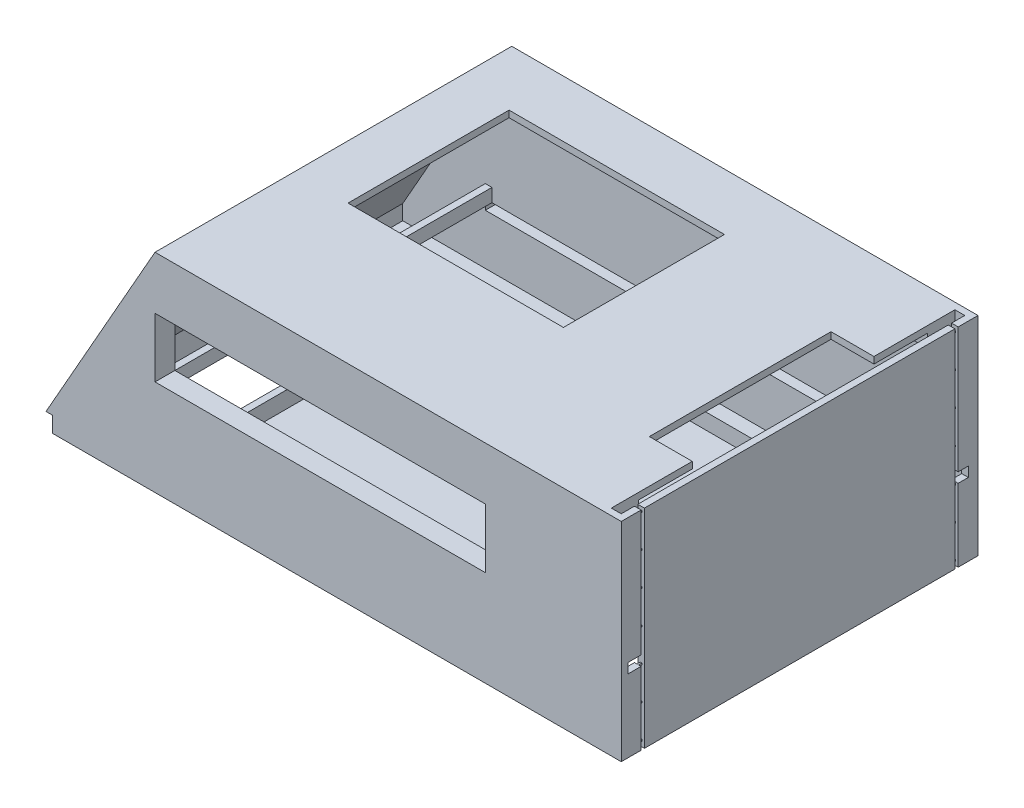
from build123d import *

# Parameters (mm, degrees)
SKETCH_1_W           = 174.15
SKETCH_1_H           = 108
EXTRUDE_1_DEPTH      = 63
CUT_EXTRUDE_2_DEPTH  = 174.15
CUT_EXTRUDE_3_REACH  = 122.279
SKETCH_6_W           = 2
SKETCH_6_H           = 108
SKETCH_7_W           = 96
SKETCH_7_H           = 50.25
CUT_EXTRUDE_5_DEPTH  = 168.15
SKETCH_8_W           = 87.5
SKETCH_8_H           = 4.75
CUT_EXTRUDE_6_DEPTH  = 168.15
SKETCH_10_W          = 168.15
SKETCH_10_H          = 87.5
CUT_EXTRUDE_8_DEPTH  = 59
SKETCH_12_W          = 168.15
SKETCH_12_H          = 96
EXTRUDE_2_DEPTH      = 2
SKETCH_15_W          = 25
SKETCH_15_H          = 70
SKETCH_15_W_2        = 55
SKETCH_15_H_2        = 20
SKETCH_15_W_3        = 44.398131355
SKETCH_15_H_3        = 87.5
CUT_EXTRUDE_9_DEPTH  = 2
SKETCH_16_W          = 25
SKETCH_16_H          = 96
SKETCH_16_W_2        = 32.283516817
CUT_EXTRUDE_10_DEPTH = 2
SKETCH_17_W          = 2
SKETCH_17_H          = 96
EXTRUDE_3_DEPTH      = 5
SKETCH_18_W          = 2
SKETCH_18_H          = 87.5
EXTRUDE_4_DEPTH      = 5
SKETCH_19_W          = 100
SKETCH_19_H          = 18
CUT_EXTRUDE_11_DEPTH = 6
CUT_EXTRUDE_12_REACH = 154.365
EXTRUDE_5_REACH      = 154.365
SKETCH_23_W          = 65.205598619
SKETCH_23_H          = 48.744694075
CUT_EXTRUDE_13_DEPTH = 2
CUT_EXTRUDE_START    = -63
CUT_EXTRUDE_14_DEPTH = 63
SKETCH_28_W          = 2
SKETCH_28_H          = 4.25
EXTRUDE_6_DEPTH      = 4.75
SKETCH_31_W          = 13
SKETCH_31_H          = 55
CUT_EXTRUDE_15_DEPTH = 10
SKETCH_34_W          = 103.070926165
SKETCH_34_H          = 3
CUT_EXTRUDE_16_DEPTH = 143.15
SKETCH_37_W          = 0.5
SKETCH_37_H          = 0.5
EXTRUDE_7_DEPTH      = 1
EXTRUDE_7_2_DEPTH    = 1
EXTRUDE_7_3_DEPTH    = 1
EXTRUDE_7_4_DEPTH    = 1
EXTRUDE_7_5_DEPTH    = 1
EXTRUDE_7_6_DEPTH    = 1
EXTRUDE_7_7_DEPTH    = 1
SKETCH_40_W          = 0.5
SKETCH_40_H          = 0.5
EXTRUDE_8_DEPTH      = 1
SKETCH_42_W          = 2.002594571
SKETCH_42_H          = 94
EXTRUDE_9_DEPTH      = 63


with BuildPart() as part:
    # 스케치1 → 보스-돌출1 (new body)
    with BuildSketch(Plane(origin=(0, 0, 0), x_dir=(1, 0, 0), z_dir=(0, 1, 0))):
        Rectangle(SKETCH_1_W, SKETCH_1_H)
    extrude(amount=EXTRUDE_1_DEPTH)

    # 스케치5 → 컷-돌출2 (cut)
    with BuildSketch(Plane.ZY.offset(87.075)):
        Polygon((-48, 0), (-47.75, 0), (-47.75, 2.75), (-45.75, 2.75), (-45.75, 4.75), (-52.25, 4.75), (-52.25, 2.75), (-50.25, 2.75), (-50.25, 0), (-50, 0), (-50, 3), (-52, 3), (-52, 4.5), (-46, 4.5), (-46, 3), (-48, 3), align=None)
        Polygon((-50, 0), (-48, 0), (-48, 3), (-46, 3), (-46, 4.5), (-52, 4.5), (-52, 3), (-50, 3), align=None)
        Polygon((50, 3), (50, 0), (50.25, 0), (50.25, 2.75), (52.25, 2.75), (52.25, 4.75), (45.75, 4.75), (45.75, 2.75), (47.75, 2.75), (47.75, 0), (48, 0), (48, 3), (46, 3), (46, 4.5), (52, 4.5), (52, 3), align=None)
        Polygon((48, 0), (50, 0), (50, 3), (52, 3), (52, 4.5), (46, 4.5), (46, 3), (48, 3), align=None)
    extrude(amount=-CUT_EXTRUDE_2_DEPTH, mode=Mode.SUBTRACT)

    # 컷-돌출3: up to this face of the body (flat: up to its plane)
    cut_extrude_3_end = Plane(part.part.faces().sort_by_distance((0, 4.75, 49))[0])
    # 스케치6 → 컷-돌출3 (cut, up to the picked face)
    with BuildSketch(Plane.XZ, mode=Mode.PRIVATE) as cut_extrude_3_sk1:
        with Locations((-86.075, 0)):
            Rectangle(SKETCH_6_W, SKETCH_6_H)
    cut_extrude_3_tool1 = split(extrude(cut_extrude_3_sk1.sketch, amount=-CUT_EXTRUDE_3_REACH, mode=Mode.PRIVATE), bisect_by=cut_extrude_3_end, keep=Keep.BOTH, mode=Mode.PRIVATE)
    add(cut_extrude_3_tool1.solids().sort_by(Axis((-86.075, 0, 0), (0, 1, 0)))[0], mode=Mode.SUBTRACT)

    # 스케치7 → 컷-돌출5 (cut)
    with BuildSketch(Plane(origin=(87.075, 0, 0), x_dir=(0, 0, -1), z_dir=(1, 0, 0))):
        with Locations((0, 31.875)):
            Rectangle(SKETCH_7_W, SKETCH_7_H)
    extrude(amount=-CUT_EXTRUDE_5_DEPTH, mode=Mode.SUBTRACT)

    # 스케치8 → 컷-돌출6 (cut)
    with BuildSketch(Plane(origin=(87.075, 0, 0), x_dir=(0, 0, -1), z_dir=(1, 0, 0))):
        with Locations((0, 4.375)):
            Rectangle(SKETCH_8_W, SKETCH_8_H)
    extrude(amount=-CUT_EXTRUDE_6_DEPTH, mode=Mode.SUBTRACT)

    # 스케치10 → 컷-돌출8 (cut)
    with BuildSketch(Plane(origin=(0, 2, 0), x_dir=(1, 0, 0), z_dir=(0, 1, 0))):
        with Locations((3, 0)):
            Rectangle(SKETCH_10_W, SKETCH_10_H)
    extrude(amount=CUT_EXTRUDE_8_DEPTH, mode=Mode.SUBTRACT)

    # 스케치12 → 보스-돌출2 (add)
    with BuildSketch(Plane(origin=(0, 24, 0), x_dir=(-1, 0, 0), z_dir=(0, -1, 0))):
        with Locations((-3, 0)):
            Rectangle(SKETCH_12_W, SKETCH_12_H)
    extrude(amount=EXTRUDE_2_DEPTH)

    # 스케치15 → 컷-돌출9 (cut)
    with BuildSketch(Plane(origin=(0, 2, 0), x_dir=(1, 0, 0), z_dir=(0, 1, 0))):
        with Locations((-68.575, 8.75)):
            Rectangle(SKETCH_15_W, SKETCH_15_H)
        with Locations((-9.233175572, -33.75)):
            Rectangle(SKETCH_15_W_2, SKETCH_15_H_2)
        with Locations((64.875934323, 0)):
            Rectangle(SKETCH_15_W_3, SKETCH_15_H_3)
    extrude(amount=-CUT_EXTRUDE_9_DEPTH, mode=Mode.SUBTRACT)

    # 스케치16 → 컷-돌출10 (cut)
    with BuildSketch(Plane(origin=(0, 24, 0), x_dir=(1, 0, 0), z_dir=(0, 1, 0))):
        with Locations((-68.575, 0)):
            Rectangle(SKETCH_16_W, SKETCH_16_H)
        with Locations((70.933241592, 0)):
            Rectangle(SKETCH_16_W_2, SKETCH_16_H)
    extrude(amount=-CUT_EXTRUDE_10_DEPTH, mode=Mode.SUBTRACT)

    # 스케치17 → 보스-돌출3 (add)
    with BuildSketch(Plane(origin=(0, 24, 0), x_dir=(1, 0, 0), z_dir=(0, 1, 0))):
        with Locations((-55.075, 0)):
            Rectangle(SKETCH_17_W, SKETCH_17_H)
    extrude(amount=EXTRUDE_3_DEPTH)

    # 스케치18 → 보스-돌출4 (add)
    with BuildSketch(Plane(origin=(0, 2, 0), x_dir=(1, 0, 0), z_dir=(0, 1, 0))):
        with Locations((-55.075, 0)):
            Rectangle(SKETCH_18_W, SKETCH_18_H)
    extrude(amount=EXTRUDE_4_DEPTH)

    # 스케치19 → 컷-돌출11 (cut)
    with BuildSketch(Plane(origin=(0, 0, 48), x_dir=(-1, 0, 0), z_dir=(0, 0, -1))):
        with Locations((4.075, 38)):
            Rectangle(SKETCH_19_W, SKETCH_19_H)
    extrude(amount=-CUT_EXTRUDE_11_DEPTH, mode=Mode.SUBTRACT)

    # 컷-돌출12: up to this face of the body (flat: up to its plane)
    cut_extrude_12_end = Plane(part.part.faces().sort_by_distance((0.074595533, 31.525240719, -54))[0])
    # 스케치20 → 컷-돌출12 (cut, up to the picked face)
    with BuildSketch(Plane.XY.offset(54), mode=Mode.PRIVATE) as cut_extrude_12_sk1:
        Polygon((-87.075, 4.75), (-54.075, 63), (-87.075, 63), align=None)
    cut_extrude_12_tool1 = split(extrude(cut_extrude_12_sk1.sketch, amount=-CUT_EXTRUDE_12_REACH, mode=Mode.PRIVATE), bisect_by=cut_extrude_12_end, keep=Keep.BOTH, mode=Mode.PRIVATE)
    add(cut_extrude_12_tool1.solids().sort_by(Axis((-76.075, 43.583333, 54), (0, 0, -1)))[0], mode=Mode.SUBTRACT)

    # 보스-돌출5: up to this face of the body (flat: up to its plane)
    extrude_5_end = Plane(part.part.faces().sort_by_distance((7.392919772, 30.366402897, -54))[0])
    # 스케치21 → 보스-돌출5 (add, up to the picked face)
    with BuildSketch(Plane.XY.offset(54), mode=Mode.PRIVATE) as extrude_5_sk1:
        Polygon((-87.075, 4.75), (-84.776349095, 4.75), (-51.776349095, 63), (-54.075, 63), align=None)
    extrude_5_tool1 = split(extrude(extrude_5_sk1.sketch, amount=-EXTRUDE_5_REACH, mode=Mode.PRIVATE), bisect_by=extrude_5_end, keep=Keep.BOTH, mode=Mode.PRIVATE)
    add(extrude_5_tool1.solids().sort_by(Axis((-69.425675, 33.875, 54), (0, 0, -1)))[0])

    # 스케치23 → 컷-돌출13 (cut)
    with BuildSketch(Plane(origin=(0, 63, 0), x_dir=(1, 0, 0), z_dir=(0, 1, 0))):
        with Locations((-5.140341164, 12.481591832)):
            Rectangle(SKETCH_23_W, SKETCH_23_H)
    extrude(amount=-CUT_EXTRUDE_13_DEPTH, mode=Mode.SUBTRACT)

    # 스케치26 → 컷-돌출14 (cut)
    with BuildSketch(Plane(origin=(0, 63, 0), x_dir=(1, 0, 0), z_dir=(0, 1, 0)).offset(CUT_EXTRUDE_START)):
        Polygon((82.075, 52), (85.075, 52), (85.075, 48), (87.075, 48), (87.075, -48), (85.075, -48), (85.075, -52), (82.075, -52), align=None)
    extrude(amount=CUT_EXTRUDE_14_DEPTH, mode=Mode.SUBTRACT)

    # 스케치28 → 보스-돌출6 (add)
    with BuildSketch(Plane.XZ.offset(-4.75)):
        with Locations((86.075, 50.125)):
            Rectangle(SKETCH_28_W, SKETCH_28_H)
        with Locations((86.075, -50.125)):
            Rectangle(SKETCH_28_W, SKETCH_28_H)
    extrude(amount=EXTRUDE_6_DEPTH)

    # 스케치31 → 컷-돌출15 (cut)
    with BuildSketch(Plane(origin=(0, 63, 0), x_dir=(1, 0, 0), z_dir=(0, 1, 0))):
        with Locations((75.575, 0)):
            Rectangle(SKETCH_31_W, SKETCH_31_H)
    extrude(amount=-CUT_EXTRUDE_15_DEPTH, mode=Mode.SUBTRACT)

    # 스케치34 → 컷-돌출16 (cut)
    with BuildSketch(Plane(origin=(87.075, 0, 0), x_dir=(0, 0, -1), z_dir=(1, 0, 0))):
        with Locations((-0.464536917, 23.5)):
            Rectangle(SKETCH_34_W, SKETCH_34_H)
    extrude(amount=-CUT_EXTRUDE_16_DEPTH, mode=Mode.SUBTRACT)

    # 스케치40 → 보스-돌출8 (add)
    with BuildSketch(Plane.XY.offset(-48)):
        with Locations((86.075, 61.396326998)):
            Rectangle(SKETCH_40_W, SKETCH_40_H)
        with Locations((86.075, 51.396326998)):
            Rectangle(SKETCH_40_W, SKETCH_40_H)
        with Locations((86.075, 41.396326998)):
            Rectangle(SKETCH_40_W, SKETCH_40_H)
        with Locations((86.075, 31.396326998)):
            Rectangle(SKETCH_40_W, SKETCH_40_H)
        with Locations((86.075, 21.396326998)):
            Rectangle(SKETCH_40_W, SKETCH_40_H)
        with Locations((86.075, 11.396326998)):
            Rectangle(SKETCH_40_W, SKETCH_40_H)
        with Locations((86.075, 1.396326998)):
            Rectangle(SKETCH_40_W, SKETCH_40_H)
    extrude(amount=EXTRUDE_8_DEPTH)



with BuildPart() as body_2:
    # 스케치37 → 보스-돌출7 (new body)
    with BuildSketch(Plane(origin=(0, 0, 48), x_dir=(-1, 0, 0), z_dir=(0, 0, -1))):
        with Locations((-86.075, 51.75934634)):
            Rectangle(SKETCH_37_W, SKETCH_37_H)
    extrude(amount=EXTRUDE_7_DEPTH)


with BuildPart() as body_3:
    # 스케치37 → Extrude 7 2 (new body)
    with BuildSketch(Plane(origin=(0, 0, 48), x_dir=(-1, 0, 0), z_dir=(0, 0, -1))):
        with Locations((-86.075, 61.75934634)):
            Rectangle(SKETCH_37_W, SKETCH_37_H)
    extrude(amount=EXTRUDE_7_2_DEPTH)


with BuildPart() as body_4:
    # 스케치37 → Extrude 7 3 (new body)
    with BuildSketch(Plane(origin=(0, 0, 48), x_dir=(-1, 0, 0), z_dir=(0, 0, -1))):
        with Locations((-86.075, 41.75934634)):
            Rectangle(SKETCH_37_W, SKETCH_37_H)
    extrude(amount=EXTRUDE_7_3_DEPTH)


with BuildPart() as body_5:
    # 스케치37 → Extrude 7 4 (new body)
    with BuildSketch(Plane(origin=(0, 0, 48), x_dir=(-1, 0, 0), z_dir=(0, 0, -1))):
        with Locations((-86.075, 31.75934634)):
            Rectangle(SKETCH_37_W, SKETCH_37_H)
    extrude(amount=EXTRUDE_7_4_DEPTH)


with BuildPart() as body_6:
    # 스케치37 → Extrude 7 5 (new body)
    with BuildSketch(Plane(origin=(0, 0, 48), x_dir=(-1, 0, 0), z_dir=(0, 0, -1))):
        with Locations((-86.075, 21.75934634)):
            Rectangle(SKETCH_37_W, SKETCH_37_H)
    extrude(amount=EXTRUDE_7_5_DEPTH)


with BuildPart() as body_7:
    # 스케치37 → Extrude 7 6 (new body)
    with BuildSketch(Plane(origin=(0, 0, 48), x_dir=(-1, 0, 0), z_dir=(0, 0, -1))):
        with Locations((-86.075, 11.75934634)):
            Rectangle(SKETCH_37_W, SKETCH_37_H)
    extrude(amount=EXTRUDE_7_6_DEPTH)


with BuildPart() as body_8:
    # 스케치37 → Extrude 7 7 (new body)
    with BuildSketch(Plane(origin=(0, 0, 48), x_dir=(-1, 0, 0), z_dir=(0, 0, -1))):
        with Locations((-86.075, 1.75934634)):
            Rectangle(SKETCH_37_W, SKETCH_37_H)
    extrude(amount=EXTRUDE_7_7_DEPTH)


with BuildPart() as part_1:
    add(part.part)

    add(body_2.part)  # 보스-돌출9 merges body 2

    add(body_3.part)  # 보스-돌출9 merges body 3

    add(body_4.part)  # 보스-돌출9 merges body 4

    add(body_5.part)  # 보스-돌출9 merges body 5

    add(body_6.part)  # 보스-돌출9 merges body 6

    add(body_7.part)  # 보스-돌출9 merges body 7

    add(body_8.part)  # 보스-돌출9 merges body 8
    # 스케치42 → 보스-돌출9 (add)
    with BuildSketch(Plane(origin=(0, 63, 0), x_dir=(1, 0, 0), z_dir=(0, 1, 0))):
        with Locations((86.076297286, 0)):
            Rectangle(SKETCH_42_W, SKETCH_42_H)
    extrude(amount=-EXTRUDE_9_DEPTH)


solid = part_1.part
